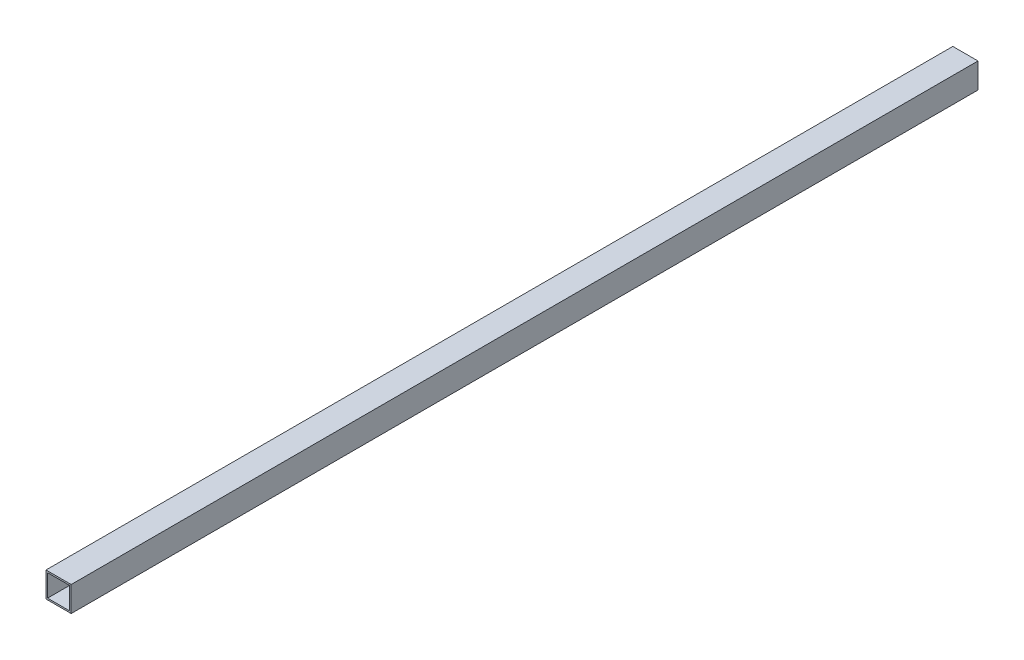
from build123d import *

# Parameters (mm, degrees)
BOSS_EXTRUDE1_DEPTH      = 457.2
BOSS_EXTRUDE1_DEPTH_BACK = 457.2
SKETCH3_W                = 25.4
SKETCH3_H                = 25.4
SKETCH3_W_2              = 22.225
SKETCH3_H_2              = 22.225


with BuildPart() as part:
    # Sketch3 → Boss-Extrude1 (new, two sides: drawn at the far end of the back side and taken through both)
    with BuildSketch(Plane.XY.offset(-BOSS_EXTRUDE1_DEPTH_BACK)):
        Rectangle(SKETCH3_W, SKETCH3_H)
        Rectangle(SKETCH3_W_2, SKETCH3_H_2, mode=Mode.SUBTRACT)
    extrude(amount=BOSS_EXTRUDE1_DEPTH + BOSS_EXTRUDE1_DEPTH_BACK)


solid = part.part
